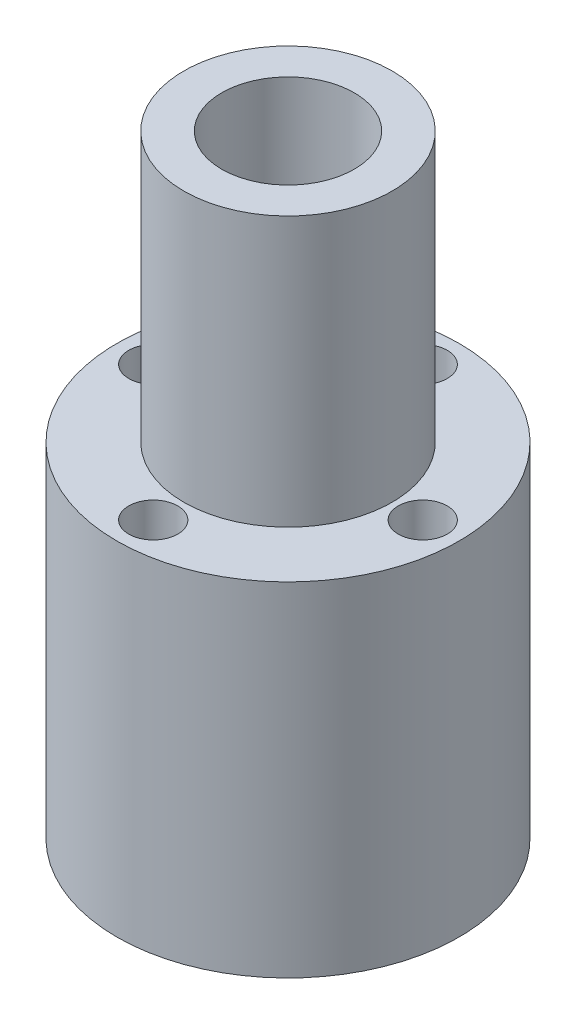
from build123d import *

# Parameters (mm, degrees)
SKETCH1_R           = 4.25
SKETCH1_R_2         = 2.7051
BOSS_EXTRUDE1_DEPTH = 11
SKETCH2_R           = 6.985
SKETCH2_R_2         = 1.75
SKETCH2_R_3         = 1
BOSS_EXTRUDE2_DEPTH = 14
CUT_EXTRUDE1_START  = -14
SKETCH3_R           = 2.1
CUT_EXTRUDE1_DEPTH  = 6


with BuildPart() as part:
    # Sketch1 → Boss-Extrude1 (new body)
    with BuildSketch(Plane(origin=(0, 0, 0), x_dir=(1, 0, 0), z_dir=(0, 1, 0))):
        with Locations(Location((0, 0, 0), (0, 0, 270))):
            Circle(SKETCH1_R)
        with Locations(Location((0, 0, 0), (0, 0, 270))):
            Circle(SKETCH1_R_2, mode=Mode.SUBTRACT)
    extrude(amount=BOSS_EXTRUDE1_DEPTH)

    # Sketch2 → Boss-Extrude2 (add)
    with BuildSketch(Plane(origin=(0, 0, 0), x_dir=(1, 0, 0), z_dir=(0, 1, 0))):
        with Locations(Location((0, 0, 0), (0, 0, 270))):
            Circle(SKETCH2_R)
        with Locations(Location((0, 0, 0), (0, 0, 270))):
            Circle(SKETCH2_R_2, mode=Mode.SUBTRACT)
        with Locations(Location((0, 5.5, 0), (0, 0, 270))):
            Circle(SKETCH2_R_3, mode=Mode.SUBTRACT)
        with Locations(Location((5.5, 0, 0), (0, 0, 270))):
            Circle(SKETCH2_R_3, mode=Mode.SUBTRACT)
        with Locations(Location((0, -5.5, 0), (0, 0, 270))):
            Circle(SKETCH2_R_3, mode=Mode.SUBTRACT)
        with Locations(Location((-5.5, 0, 0), (0, 0, 270))):
            Circle(SKETCH2_R_3, mode=Mode.SUBTRACT)
    extrude(amount=-BOSS_EXTRUDE2_DEPTH)

    # Sketch3 → Cut-Extrude1 (cut)
    with BuildSketch(Plane(origin=(0, 0, 0), x_dir=(1, 0, 0), z_dir=(0, 1, 0)).offset(CUT_EXTRUDE1_START)):
        with Locations(Location((0, 0, 0), (0, 0, 270))):
            Circle(SKETCH3_R)
    extrude(amount=CUT_EXTRUDE1_DEPTH, mode=Mode.SUBTRACT)


solid = part.part
